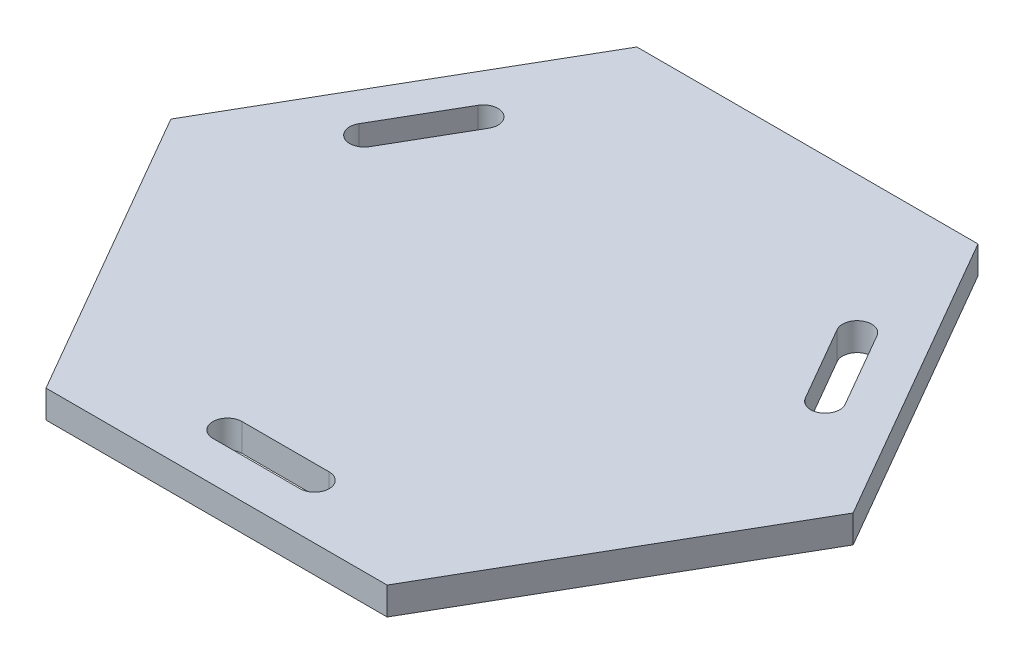
from build123d import *

# Parameters (mm, degrees)
BOSS_EXTRUDE1_DEPTH = 19.05
CUT_EXTRUDE1_DEPTH  = 311.977162881


with BuildPart() as part:
    # Sketch1 → Boss-Extrude1 (new body)
    with BuildSketch(Plane(origin=(0, 0, 0), x_dir=(1, 0, 0), z_dir=(0, 1, 0))):
        Polygon((-234.635149399, 0), (-117.317574699, -203.2), (117.317574699, -203.2), (234.635149399, 0), (117.317574699, 203.2), (-117.317574699, 203.2), align=None)
    extrude(amount=BOSS_EXTRUDE1_DEPTH)

    # Sketch2 → Cut-Extrude1 (cut, through all)
    with BuildSketch(Plane(origin=(0, 19.05, 0), x_dir=(1, 0, 0), z_dir=(0, 1, 0))):
        with BuildLine():
            Line((-29.972, -155.702), (29.972, -155.702))
            ThreePointArc((29.972, -155.702), (40.005, -165.735), (29.972, -175.768))
            Line((29.972, -175.768), (-29.972, -175.768))
            ThreePointArc((-29.972, -175.768), (-40.005, -165.735), (-29.972, -155.702))
        make_face()
        with BuildLine():
            Line((-119.85588742, 103.807513402), (-149.82788742, 51.894486598))
            ThreePointArc((-149.82788742, 51.894486598), (-163.533220296, 48.222153722), (-167.205553172, 61.927486598))
            Line((-167.205553172, 61.927486598), (-137.233553172, 113.840513402))
            ThreePointArc((-137.233553172, 113.840513402), (-123.528220296, 117.512846278), (-119.85588742, 103.807513402))
        make_face()
        with BuildLine():
            Line((149.82788742, 51.894486598), (119.85588742, 103.807513402))
            ThreePointArc((119.85588742, 103.807513402), (123.528220296, 117.512846278), (137.233553172, 113.840513402))
            Line((137.233553172, 113.840513402), (167.205553172, 61.927486598))
            ThreePointArc((167.205553172, 61.927486598), (163.533220296, 48.222153722), (149.82788742, 51.894486598))
        make_face()
    extrude(amount=-CUT_EXTRUDE1_DEPTH, mode=Mode.SUBTRACT)


solid = part.part
